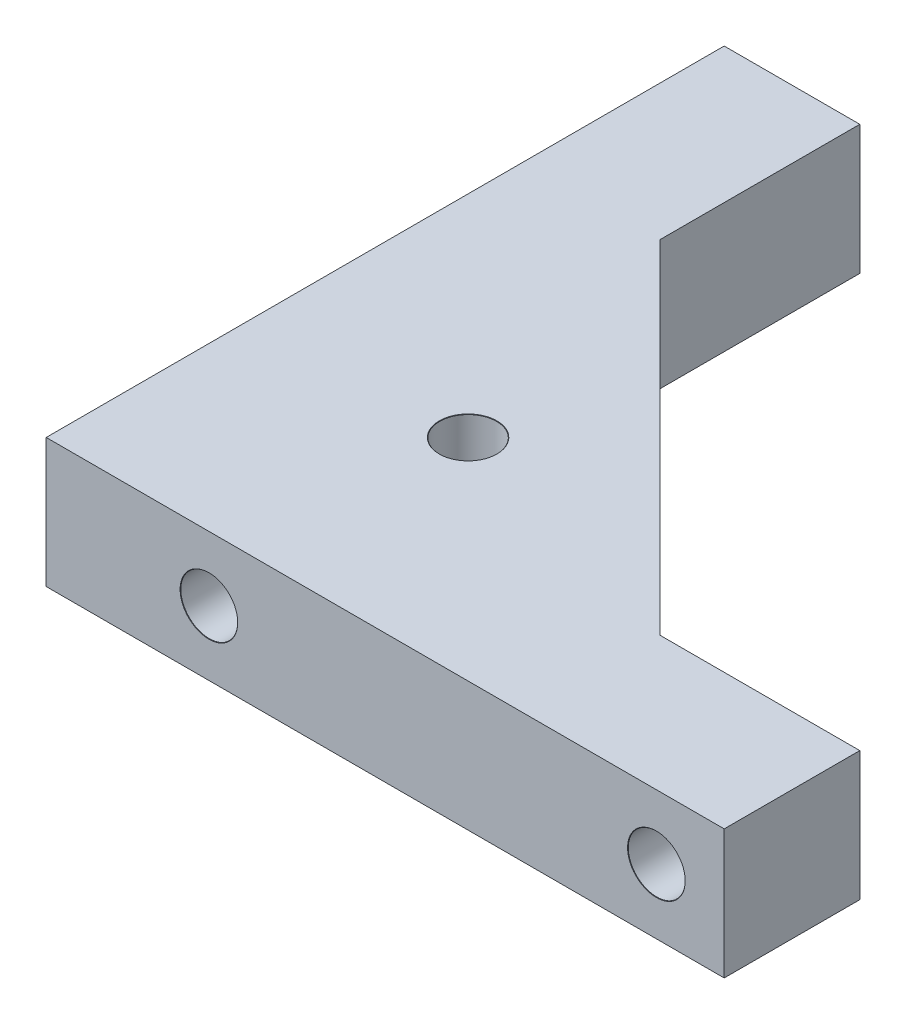
from build123d import *

# Parameters (mm, degrees)
BOSS_EXTRUDE1_DEPTH                  = 4.7625
TAP_DRILL_FOR_M5X0_8_TAP1_AT_2_COUNT = 2
TAP_DRILL_FOR_M5X0_8_TAP1_AT_2_PITCH = 33


with BuildPart() as part:
    # Sketch1 → Boss-Extrude1 (new, symmetric)
    with BuildSketch(Plane(origin=(0, 0, 0), x_dir=(1, 0, 0), z_dir=(0, 1, 0))):
        Polygon((0, 0), (50, 0), (50, 10), (35.254833996, 10), (10, 35.254833996), (10, 50), (0, 50), align=None)
    extrude(amount=BOSS_EXTRUDE1_DEPTH, both=True)

    # Sketch6 → Tap Drill for M5x0.8 Tap1 (revolve, cut)
    with BuildSketch(Plane(origin=(12, 0, 0), x_dir=(0, -1, 0), z_dir=(1, 0, 0))):
        Polygon((0, 0), (0, 9.2618073), (2.1, 8), (2.1, 0.025), (2.125, 0), align=None)
    tap_drill_for_m5x0_8_tap1 = revolve(axis=Axis((12, 0, 6.35), (0, 0, -1)), mode=Mode.SUBTRACT)

    # Tap Drill for M5x0.8 Tap1 at 2: Tap Drill for M5x0.8 Tap1 ×2
    with Locations(*[(i * TAP_DRILL_FOR_M5X0_8_TAP1_AT_2_PITCH, 0, 0) for i in range(1, TAP_DRILL_FOR_M5X0_8_TAP1_AT_2_COUNT)]):
        add(tap_drill_for_m5x0_8_tap1, mode=Mode.SUBTRACT)

    # Mirror1: Tap Drill for M5x0.8 Tap1 across plane
    add(tap_drill_for_m5x0_8_tap1.mirror(Plane(origin=(0, 0, 0), x_dir=(-0.7071067811865478, 0, 0.7071067811865472), z_dir=(0.7071067811865475, 0, 0.7071067811865477))), mode=Mode.SUBTRACT)

    # Mirror1 copy 1 sketch → Mirror1 copy 1 (revolve, cut)
    with BuildSketch(Plane(origin=(0, 0, -45), x_dir=(0, -1, 0), z_dir=(0, 0, -1))):
        Polygon((0, 0), (0, -9.2618073), (2.1, -8), (2.1, -0.025), (2.125, 0), align=None)
    revolve(axis=Axis((-6.35, 0, -45), (-1, 0, 0)), mode=Mode.SUBTRACT)

    # Sketch10 → Tap Drill for M5x0.8 Tap2 (revolve, cut)
    with BuildSketch(Plane(origin=(15.556349186, 4.7625, -15.556349186), x_dir=(0, 0, 1), z_dir=(1, 0, 0))):
        Polygon((0, 0), (0, 9.525), (2.125, 9.525), (2.1, 9.5), (2.1, 0.025), (2.125, 0), align=None)
    revolve(axis=Axis((15.556349186, 11.1125, -15.556349186), (0, -1, 0)), mode=Mode.SUBTRACT)


solid = part.part
